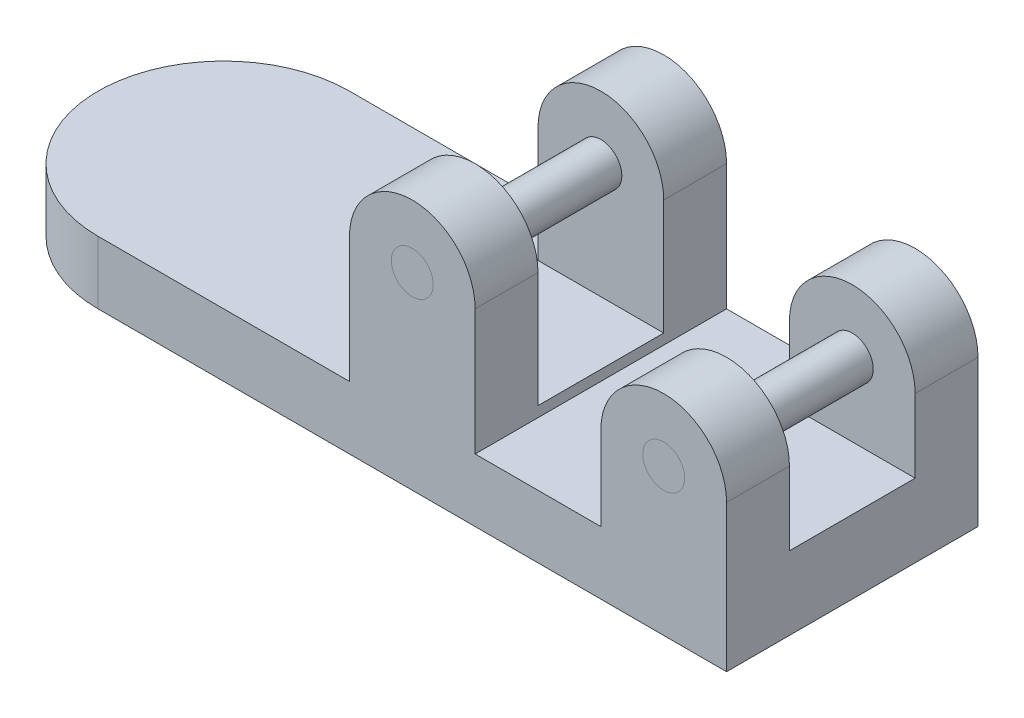
from build123d import *

# Parameters (mm, degrees)
BOSS_EXTRUDE1_DEPTH = 15
BOSS_EXTRUDE2_DEPTH = 60
SKETCH3_W           = 30
SKETCH3_H           = 17.5
SKETCH3_H_2         = 34.418211048
CUT_EXTRUDE1_DEPTH  = 199.997487421
BOSS_EXTRUDE3_START = -45
SKETCH4_R           = 5
BOSS_EXTRUDE3_DEPTH = 30


with BuildPart() as part:
    # Sketch1 → Boss-Extrude1 (new body)
    with BuildSketch(Plane(origin=(0, 0, 0), x_dir=(1, 0, 0), z_dir=(0, 1, 0))):
        with BuildLine():
            Line((0, 0), (150, 0))
            Line((150, 0), (150, 60))
            Line((150, 60), (0, 60))
            ThreePointArc((0, 60), (-30, 30), (0, 0))
        make_face()
    extrude(amount=BOSS_EXTRUDE1_DEPTH)

    # Sketch2 → Boss-Extrude2 (add)
    with BuildSketch(Plane.XY):
        with BuildLine():
            Line((60, 15), (90, 15))
            Line((90, 15), (90, 45))
            ThreePointArc((90, 45), (75, 60), (60, 45))
            Line((60, 45), (60, 15))
        make_face()
        with BuildLine():
            Line((120, 15), (150, 15))
            Line((150, 15), (150, 35))
            ThreePointArc((150, 35), (135, 50), (120, 35))
            Line((120, 35), (120, 15))
        make_face()
    extrude(amount=-BOSS_EXTRUDE2_DEPTH)

    # Sketch3 → Cut-Extrude1 (cut, through all)
    with BuildSketch(Plane(origin=(150, 0, 0), x_dir=(0, 0, -1), z_dir=(1, 0, 0))):
        with Locations((30, 26.25)):
            Rectangle(SKETCH3_W, SKETCH3_H)
        with Locations((30, 52.209105524)):
            Rectangle(SKETCH3_W, SKETCH3_H_2)
    extrude(amount=-CUT_EXTRUDE1_DEPTH, mode=Mode.SUBTRACT)

    # Sketch4 → Boss-Extrude3 (add)
    with BuildSketch(Plane.XY.offset(BOSS_EXTRUDE3_START)):
        with Locations(Location((135, 35, 0), (0, 0, 180))):
            Circle(SKETCH4_R)
        with Locations(Location((75, 45, 0), (0, 0, 180))):
            Circle(SKETCH4_R)
    extrude(amount=BOSS_EXTRUDE3_DEPTH)


solid = part.part
